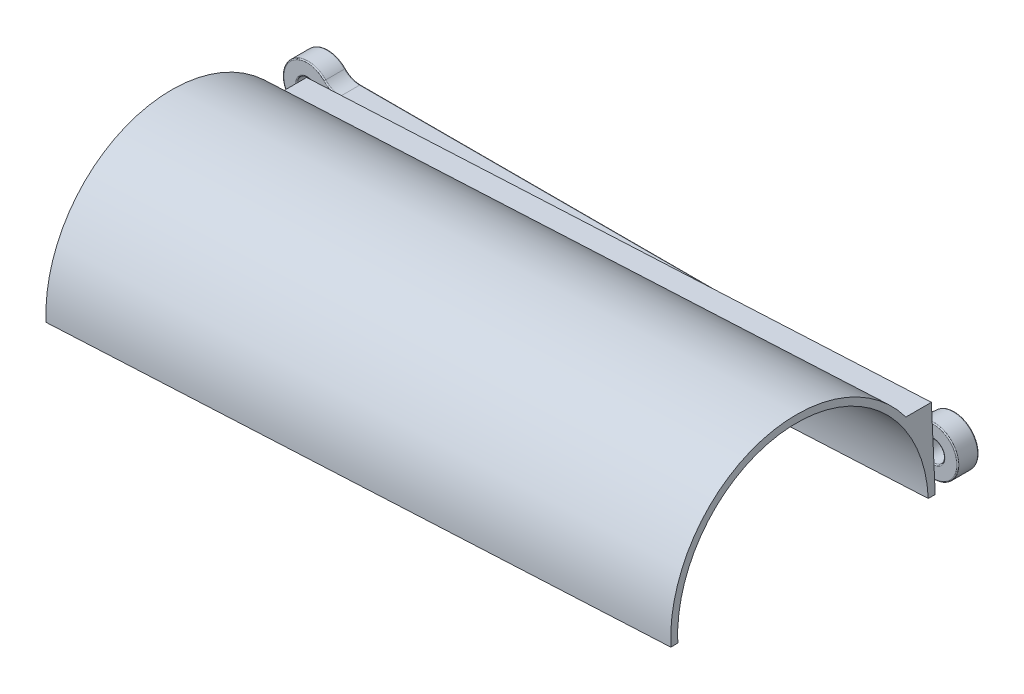
from build123d import *

# Parameters (mm, degrees)
SKETCH1_R           = 3.5
SKETCH1_R_2         = 1.5
BOSS_EXTRUDE1_DEPTH = 1.5
FILLET1_R           = 3
FILLET2_R           = 0.15
EXTRUDE_1_DEPTH     = 89.888950514


with BuildPart() as part:
    # Sketch1 → Boss-Extrude1 (new, symmetric)
    # profile 1 of 3: a face of its own
    with BuildSketch(Plane.XY):
        Circle(SKETCH1_R)
        Circle(SKETCH1_R_2, mode=Mode.SUBTRACT)
    # profile 2 of 3: a face of its own
    with BuildSketch(Plane.XY):
        with BuildLine():
            ThreePointArc((3.5, 0), (3.414525722, -0.768774411), (3.16227766, -1.5))
            Line((3.16227766, -1.5), (86.83772234, -1.5))
            ThreePointArc((86.83772234, -1.5), (86.5, 0), (86.83772234, 1.5))
            Line((86.83772234, 1.5), (3.16227766, 1.5))
            ThreePointArc((3.16227766, 1.5), (3.414525722, 0.768774411), (3.5, 0))
        make_face()
    # profile 3 of 3: a face of its own
    with BuildSketch(Plane.XY):
        with Locations((90, 0)):
            Circle(SKETCH1_R)
        with Locations((90, 0)):
            Circle(SKETCH1_R_2, mode=Mode.SUBTRACT)
    extrude(amount=BOSS_EXTRUDE1_DEPTH, both=True)

    # Fillet1
    fillet1_edges = [part.edges().sort_by_distance(p)[0] for p in [
        (86.83772234, 1.5, 0),
        (86.83772234, -1.5, 0),
        (3.16227766, -1.5, 0),
        (3.16227766, 1.5, 0),
    ]]
    fillet(fillet1_edges, radius=FILLET1_R)

    # Fillet2
    fillet2_edges = [part.edges().sort_by_distance(p)[0] for p in [
        (45, -1.5, -1.5),
        (45, -1.5, 1.5),
        (-1.5, 0, 1.5),
        (-3.5, 0, -1.5),
        (-3.5, 0, 1.5),
        (93.5, 0, -1.5),
        (93.5, 0, 1.5),
        (88.5, 0, 1.5),
        (45, 1.5, -1.5),
        (45, 1.5, 1.5),
        (3.513718949, -1.740401367, -1.5),
        (3.513718949, -1.740401367, 1.5),
        (86.486281051, -1.740401367, -1.5),
        (86.486281051, -1.740401367, 1.5),
        (86.486281051, 1.740401367, -1.5),
        (86.486281051, 1.740401367, 1.5),
        (3.513718949, 1.740401367, -1.5),
        (3.513718949, 1.740401367, 1.5),
        (88.5, 0, -1.5),
        (-1.5, 0, -1.5),
    ]]
    fillet(fillet2_edges, radius=FILLET2_R)

    # 草图3 → 凸台-拉伸1 (add)
    with BuildSketch(Plane(origin=(0, 0, 0), x_dir=(0, 0, 1), z_dir=(-0.9987661168213675, -0.04966129166228532, 0))):
        with BuildLine():
            Line((1.5, -9.709999982), (2.5, -9.709999982))
            ThreePointArc((2.5, -9.709999982), (20.5, 8.290000018), (38.5, -9.709999982))
            Line((38.5, -9.709999982), (39.5, -9.709999982))
            ThreePointArc((39.5, -9.709999982), (26.396076166, 8.352012249), (5.159338333, 1.5))
            Line((5.159338333, 1.5), (1.5, 1.5))
            Line((1.5, 1.5), (1.5, 0))
            Line((1.5, 0), (1.5, -9.709999982))
        make_face()
    extrude(amount=-EXTRUDE_1_DEPTH)


solid = part.part
